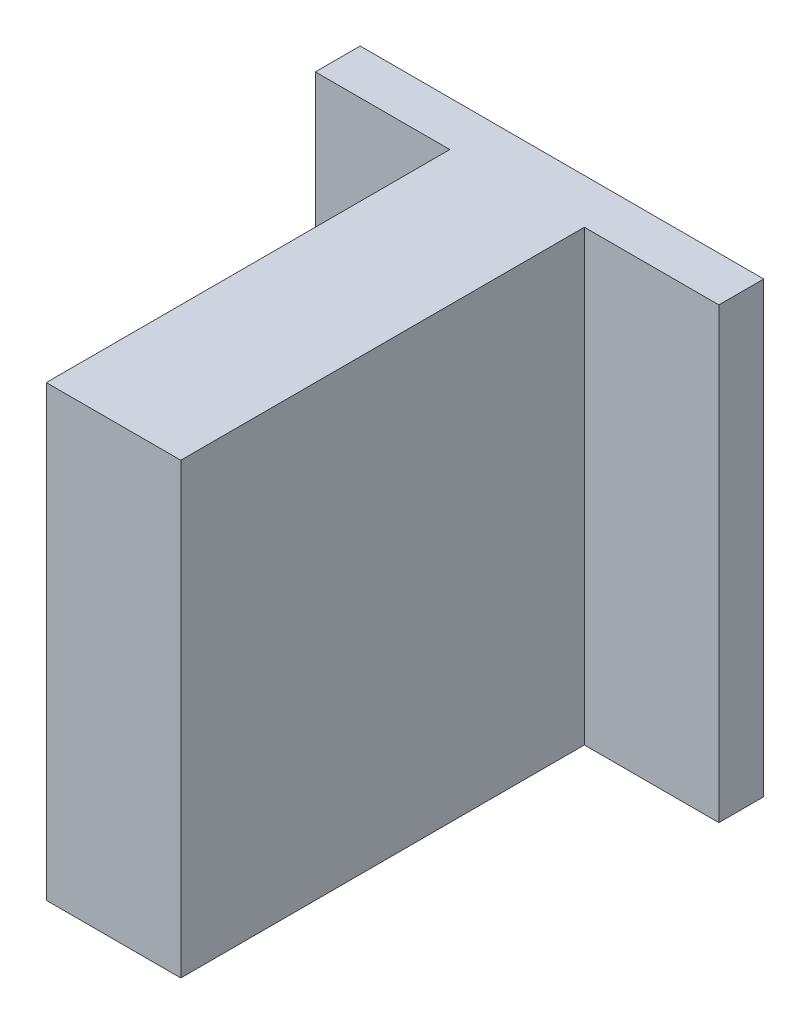
from build123d import *

# Parameters (mm, degrees)
SKETCH1_W           = 25.4
SKETCH1_H           = 25.4
BOSS_EXTRUDE1_DEPTH = 3.81
SKETCH2_W           = 7.62
SKETCH2_H           = 25.4
BOSS_EXTRUDE2_DEPTH = 2.54


with BuildPart() as part:
    # Sketch1 → Boss-Extrude1 (new body)
    with BuildSketch(Plane(origin=(0, 0, 0), x_dir=(0, 0, -1), z_dir=(1, 0, 0))):
        with Locations((-12.7, 12.7)):
            Rectangle(SKETCH1_W, SKETCH1_H)
    boss_extrude1 = extrude(amount=BOSS_EXTRUDE1_DEPTH)

    # Sketch2 → Boss-Extrude2 (add)
    with BuildSketch(Plane.XY):
        with Locations((-3.81, 12.7)):
            Rectangle(SKETCH2_W, SKETCH2_H)
    boss_extrude2 = extrude(amount=BOSS_EXTRUDE2_DEPTH)

    # Mirror2: Boss-Extrude1, Boss-Extrude2 across plane
    add(boss_extrude1.mirror(Plane(origin=(3.81, 0, 0), x_dir=(0, 0, 1), z_dir=(1, 0, 0))))
    add(boss_extrude2.mirror(Plane(origin=(3.81, 0, 0), x_dir=(0, 0, 1), z_dir=(1, 0, 0))))


solid = part.part
